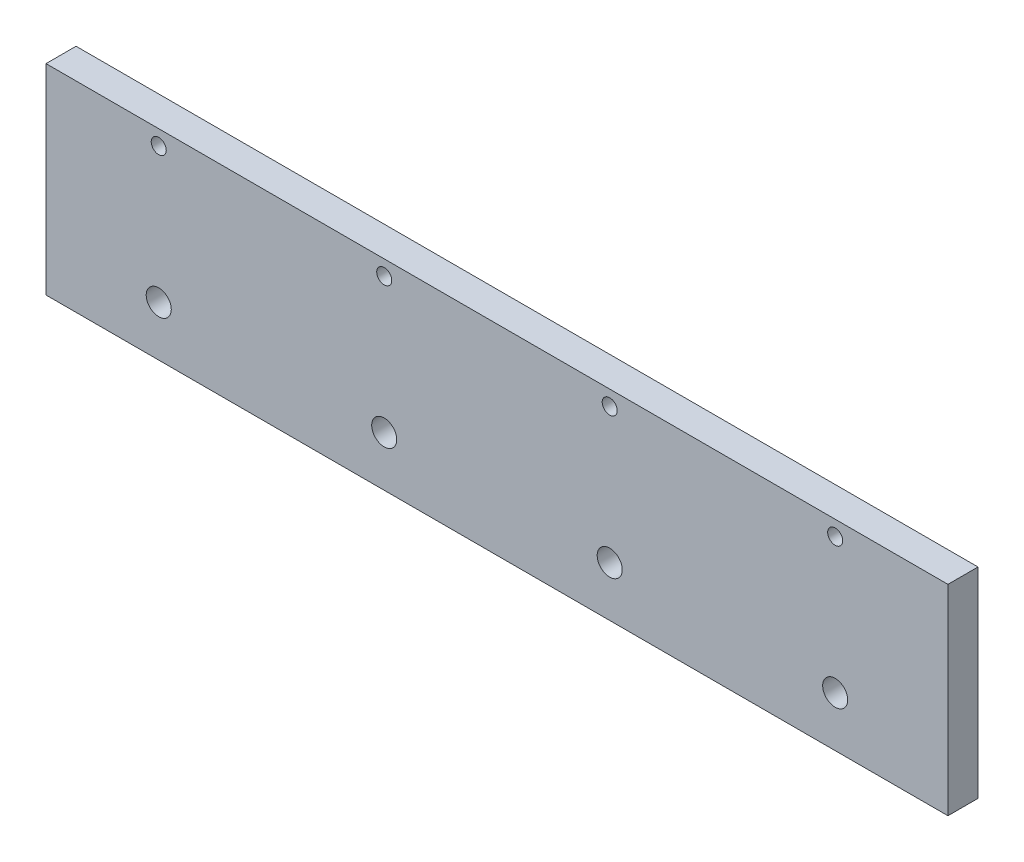
from build123d import *

# Parameters (mm, degrees)
SKETCH1_W           = 360
SKETCH1_H           = 80
BOSS_EXTRUDE1_DEPTH = 12
CUT_EXTRUDE1_REACH  = 186.781
SKETCH2_R           = 3
SKETCH2_R_2         = 5
LPATTERN1_COUNT     = 4
LPATTERN1_PITCH     = 90


with BuildPart() as part:
    # Sketch1 → Boss-Extrude1 (new body)
    with BuildSketch(Plane.XY):
        Rectangle(SKETCH1_W, SKETCH1_H)
    extrude(amount=BOSS_EXTRUDE1_DEPTH)

    # Sketch2 → Cut-Extrude1 (cut, up to next)
    with BuildSketch(Plane.XY.offset(12), mode=Mode.PRIVATE) as cut_extrude1_sk1:
        with Locations((-135, 34)):
            Circle(SKETCH2_R)
    cut_extrude1_tool1 = extrude(cut_extrude1_sk1.sketch, amount=-CUT_EXTRUDE1_REACH, mode=Mode.PRIVATE) & part.part
    # Sketch2 → Cut-Extrude1 (cut, up to next)
    with BuildSketch(Plane.XY.offset(12), mode=Mode.PRIVATE) as cut_extrude1_sk2:
        with Locations((-135, -20)):
            Circle(SKETCH2_R_2)
    cut_extrude1_tool2 = extrude(cut_extrude1_sk2.sketch, amount=-CUT_EXTRUDE1_REACH, mode=Mode.PRIVATE) & part.part
    cut_extrude1_1 = cut_extrude1_tool1.solids().sort_by_distance((-135, 34, 12))[0]
    add(cut_extrude1_1, mode=Mode.SUBTRACT)
    cut_extrude1_2 = cut_extrude1_tool2.solids().sort_by_distance((-135, -20, 12))[0]
    add(cut_extrude1_2, mode=Mode.SUBTRACT)
    cut_extrude1 = cut_extrude1_1 + cut_extrude1_2  # Cut-Extrude1 as one shape, for the pattern or mirror that repeats it

    # LPattern1: Cut-Extrude1 ×4
    with Locations(*[(i * LPATTERN1_PITCH, 0, 0) for i in range(1, LPATTERN1_COUNT)]):
        add(cut_extrude1, mode=Mode.SUBTRACT)


solid = part.part
